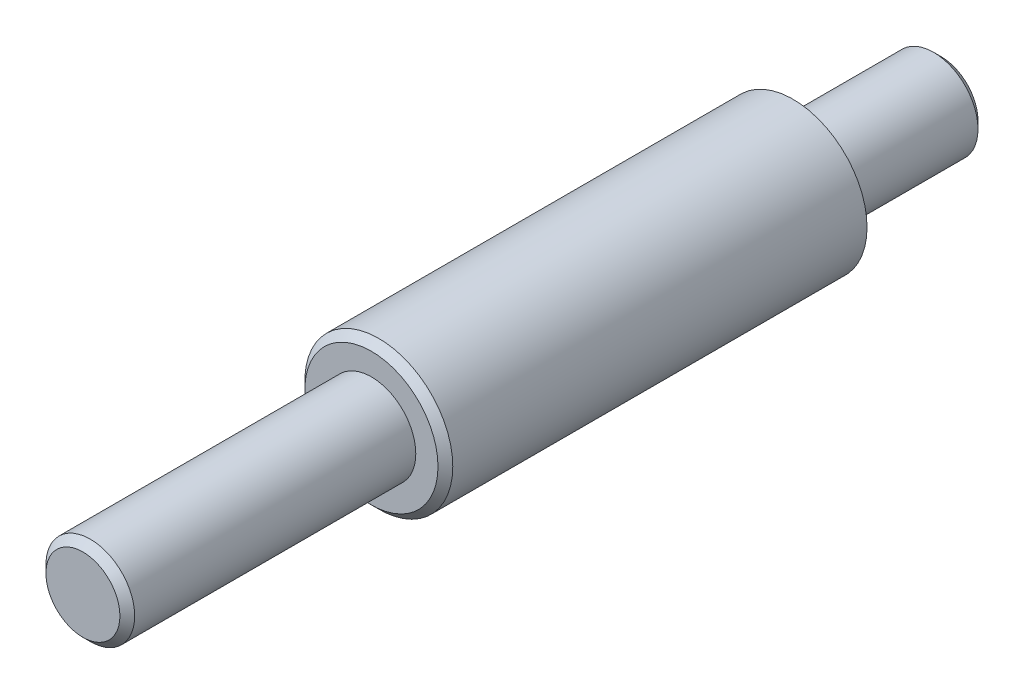
from build123d import *


with BuildPart() as part:
    # Sketch1 → Revolve1 (revolve)
    with BuildSketch(Plane(origin=(0, 0, 0), x_dir=(1, 0, 0), z_dir=(0, 1, 0))):
        Polygon((2.5, 0), (0, 0), (0, -58), (2.5, -58), (3, -57.5), (3, -38.5), (4.5, -38.5), (5, -38), (5, -10), (3, -10), (3, -0.5), align=None)
    revolve(axis=Axis((0, 0, 0), (0, 0, 1)))


solid = part.part
